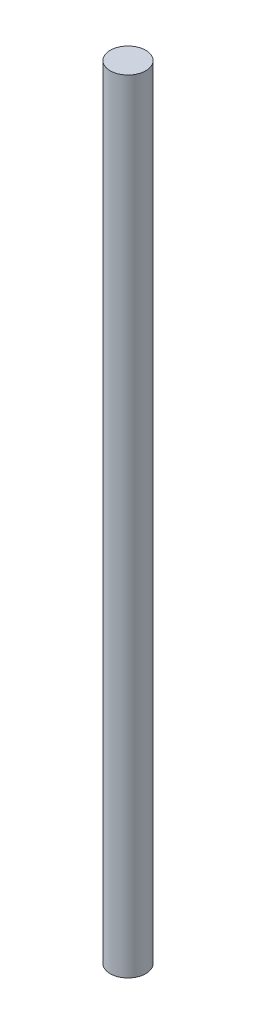
from build123d import *

# Parameters (mm, degrees)
SKETCH1_R           = 0.5
BOSS_EXTRUDE1_DEPTH = 22


with BuildPart() as part:
    # Sketch1 → Boss-Extrude1 (new body)
    with BuildSketch(Plane(origin=(0, 0, 0), x_dir=(1, 0, 0), z_dir=(0, 1, 0))):
        with Locations(Location((0, 0, 0), (0, 0, 270))):
            Circle(SKETCH1_R)
    extrude(amount=BOSS_EXTRUDE1_DEPTH)


solid = part.part
